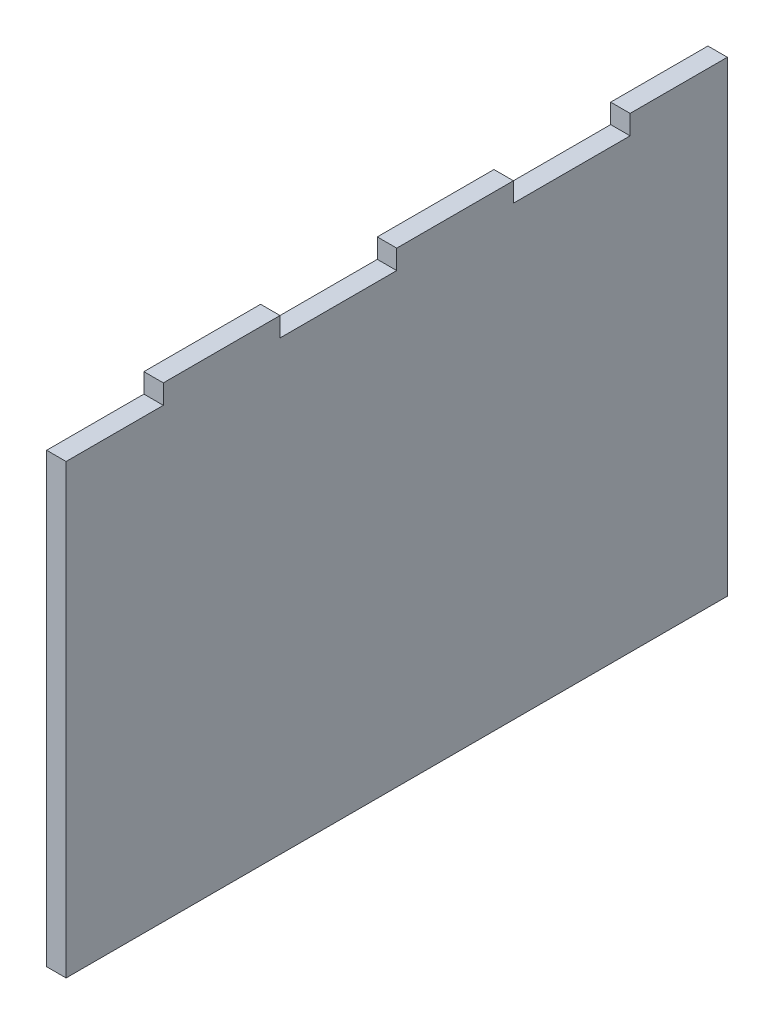
from build123d import *

# Parameters (mm, degrees)
SKETCH1_W           = 431.8
SKETCH1_H           = 304.8
BOSS_EXTRUDE1_DEPTH = 12.7
SKETCH2_W           = 63.5
SKETCH2_H           = 12.7
SKETCH2_W_2         = 76.2
CUT_EXTRUDE1_DEPTH  = 265.574866531


with BuildPart() as part:
    # Sketch1 → Boss-Extrude1 (new body)
    with BuildSketch(Plane(origin=(0, 0, 0), x_dir=(0, 0, -1), z_dir=(1, 0, 0))):
        Rectangle(SKETCH1_W, SKETCH1_H)
    extrude(amount=BOSS_EXTRUDE1_DEPTH)

    # Sketch2 → Cut-Extrude1 (cut, through all)
    with BuildSketch(Plane(origin=(12.7, 0, 0), x_dir=(0, 0, -1), z_dir=(1, 0, 0))):
        with Locations((-184.15, 146.05)):
            Rectangle(SKETCH2_W, SKETCH2_H)
        with Locations((-38.1, 146.05)):
            Rectangle(SKETCH2_W_2, SKETCH2_H)
        with Locations((114.3, 146.05)):
            Rectangle(SKETCH2_W_2, SKETCH2_H)
    extrude(amount=-CUT_EXTRUDE1_DEPTH, mode=Mode.SUBTRACT)


solid = part.part
